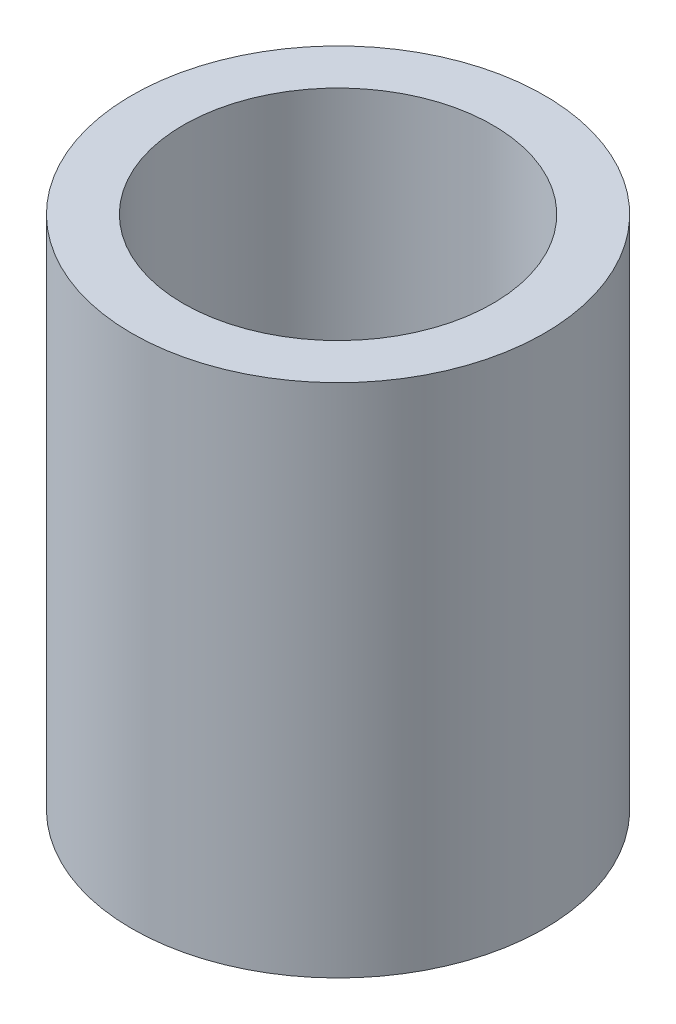
from build123d import *

# Parameters (mm, degrees)
SKETCH1_R           = 8
SKETCH1_R_2         = 6
BOSS_EXTRUDE1_DEPTH = 20


with BuildPart() as part:
    # Sketch1 → Boss-Extrude1 (new body)
    with BuildSketch(Plane(origin=(0, 0, 0), x_dir=(1, 0, 0), z_dir=(0, 1, 0))):
        with Locations(Location((0, 0, 0), (0, 0, 270))):
            Circle(SKETCH1_R)
        with Locations(Location((0, 0, 0), (0, 0, 270))):
            Circle(SKETCH1_R_2, mode=Mode.SUBTRACT)
    extrude(amount=BOSS_EXTRUDE1_DEPTH)


solid = part.part
